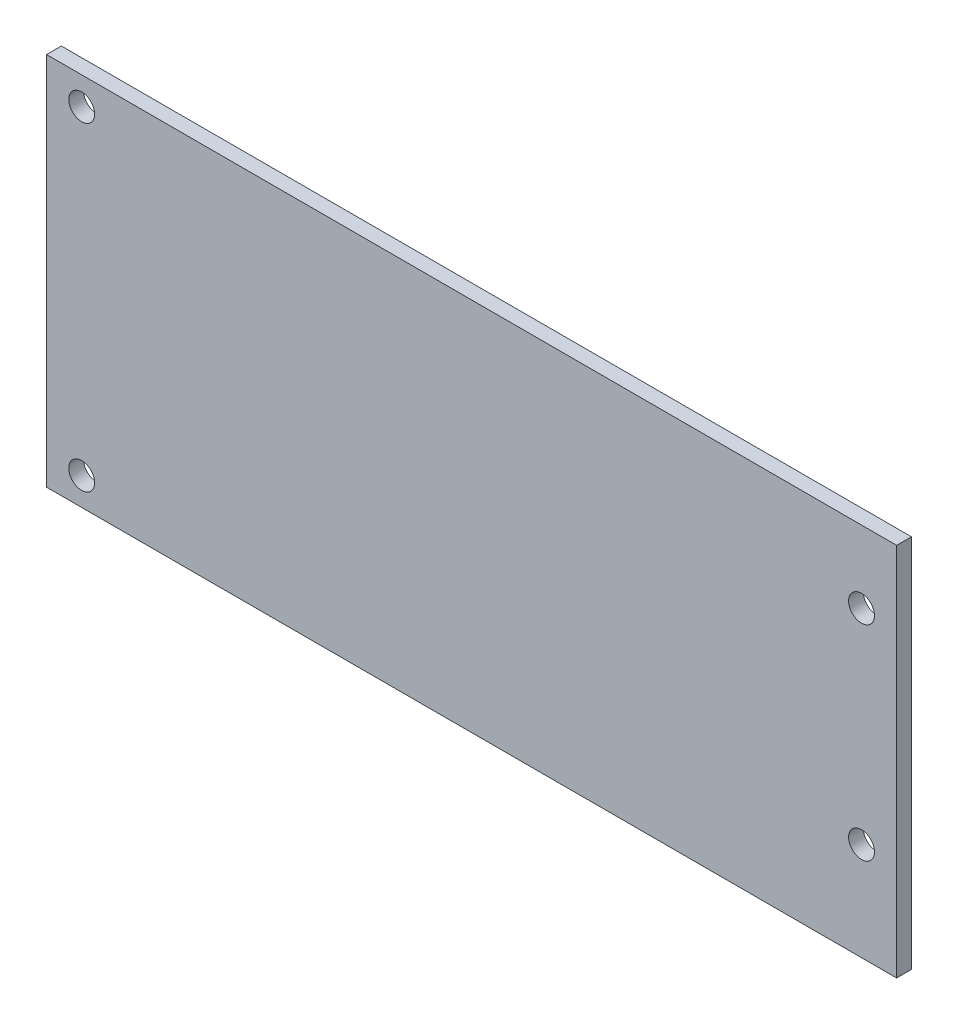
from build123d import *

# Parameters (mm, degrees)
SKETCH1_W           = 115
SKETCH1_H           = 50.691245182
BOSS_EXTRUDE1_DEPTH = 2
SKETCH2_R           = 1.75
CUT_EXTRUDE1_DEPTH  = 68.974573571


with BuildPart() as part:
    # Sketch1 → Boss-Extrude1 (new body)
    with BuildSketch(Plane.XY):
        with Locations((1.1343617, 8.984455769)):
            Rectangle(SKETCH1_W, SKETCH1_H)
    extrude(amount=BOSS_EXTRUDE1_DEPTH)

    # Sketch2 → Cut-Extrude1 (cut, through all)
    with BuildSketch(Plane.XY.offset(2)):
        with Locations((-51.6156383, 30.58007836)):
            Circle(SKETCH2_R)
        with Locations((53.8843617, 24.58007836)):
            Circle(SKETCH2_R)
        with Locations((-51.6156383, -12.611166822)):
            Circle(SKETCH2_R)
        with Locations((53.8843617, -3.111166822)):
            Circle(SKETCH2_R)
    extrude(amount=-CUT_EXTRUDE1_DEPTH, mode=Mode.SUBTRACT)


solid = part.part
